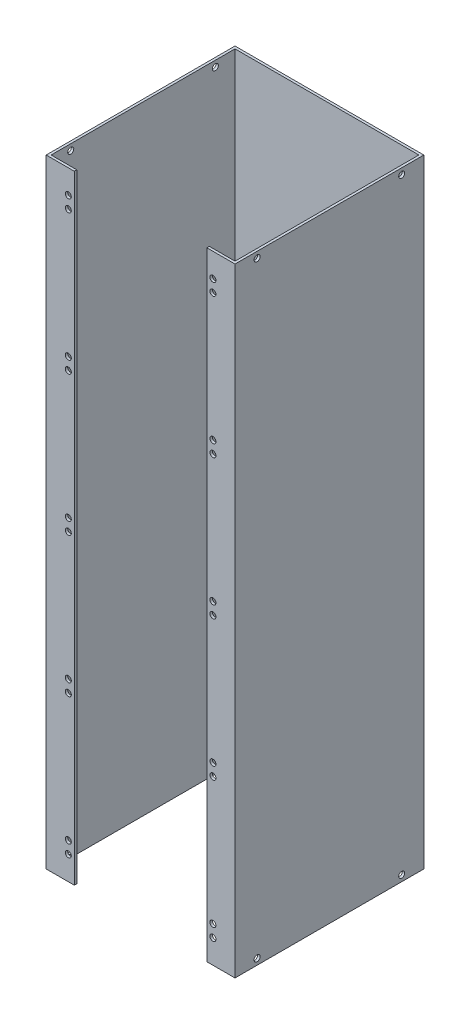
from build123d import *

# Parameters (mm, degrees)
BOSS_EXTRUDE1_DEPTH = 327.5
SKETCH2_R           = 1.6
CUT_EXTRUDE1_DEPTH  = 1.3
SKETCH4_R           = 1.6
CUT_EXTRUDE2_DEPTH  = 100


with BuildPart() as part:
    # Sketch1 → Boss-Extrude1 (new body)
    with BuildSketch(Plane(origin=(0, 0, 0), x_dir=(1, 0, 0), z_dir=(0, 1, 0))):
        Polygon((0, 0), (14.9, 0), (14.9, 1.3), (1.3, 1.3), (1.3, 98.7), (98.7, 98.7), (98.7, 1.3), (85.1, 1.3), (85.1, 0), (100, 0), (100, 100), (0, 100), align=None)
    extrude(amount=BOSS_EXTRUDE1_DEPTH)

    # Sketch2 → Cut-Extrude1 (cut)
    with BuildSketch(Plane.XY):
        with Locations((11.7, 314.9)):
            Circle(SKETCH2_R)
        with Locations((11.7, 308.5)):
            Circle(SKETCH2_R)
        with Locations((11.7, 240.925)):
            Circle(SKETCH2_R)
        with Locations((11.7, 234.525)):
            Circle(SKETCH2_R)
        with Locations((11.7, 166.95)):
            Circle(SKETCH2_R)
        with Locations((11.7, 160.55)):
            Circle(SKETCH2_R)
        with Locations((11.7, 92.975)):
            Circle(SKETCH2_R)
        with Locations((11.7, 86.575)):
            Circle(SKETCH2_R)
        with Locations((11.7, 19)):
            Circle(SKETCH2_R)
        with Locations((11.7, 12.6)):
            Circle(SKETCH2_R)
        with Locations((88.3, 314.9)):
            Circle(SKETCH2_R)
        with Locations((88.3, 308.5)):
            Circle(SKETCH2_R)
        with Locations((88.3, 240.925)):
            Circle(SKETCH2_R)
        with Locations((88.3, 234.525)):
            Circle(SKETCH2_R)
        with Locations((88.3, 166.95)):
            Circle(SKETCH2_R)
        with Locations((88.3, 160.55)):
            Circle(SKETCH2_R)
        with Locations((88.3, 19)):
            Circle(SKETCH2_R)
        with Locations((88.3, 12.6)):
            Circle(SKETCH2_R)
        with Locations((88.3, 86.575)):
            Circle(SKETCH2_R)
        with Locations((88.3, 92.975)):
            Circle(SKETCH2_R)
    extrude(amount=-CUT_EXTRUDE1_DEPTH, mode=Mode.SUBTRACT)

    # Sketch4 → Cut-Extrude2 (cut)
    with BuildSketch(Plane.ZY):
        with Locations((-88.3, 324.3)):
            Circle(SKETCH4_R)
        with Locations((-11.7, 324.3)):
            Circle(SKETCH4_R)
        with Locations((-88.3, 3.2)):
            Circle(SKETCH4_R)
        with Locations((-11.7, 3.2)):
            Circle(SKETCH4_R)
    extrude(amount=-CUT_EXTRUDE2_DEPTH, mode=Mode.SUBTRACT)


solid = part.part
